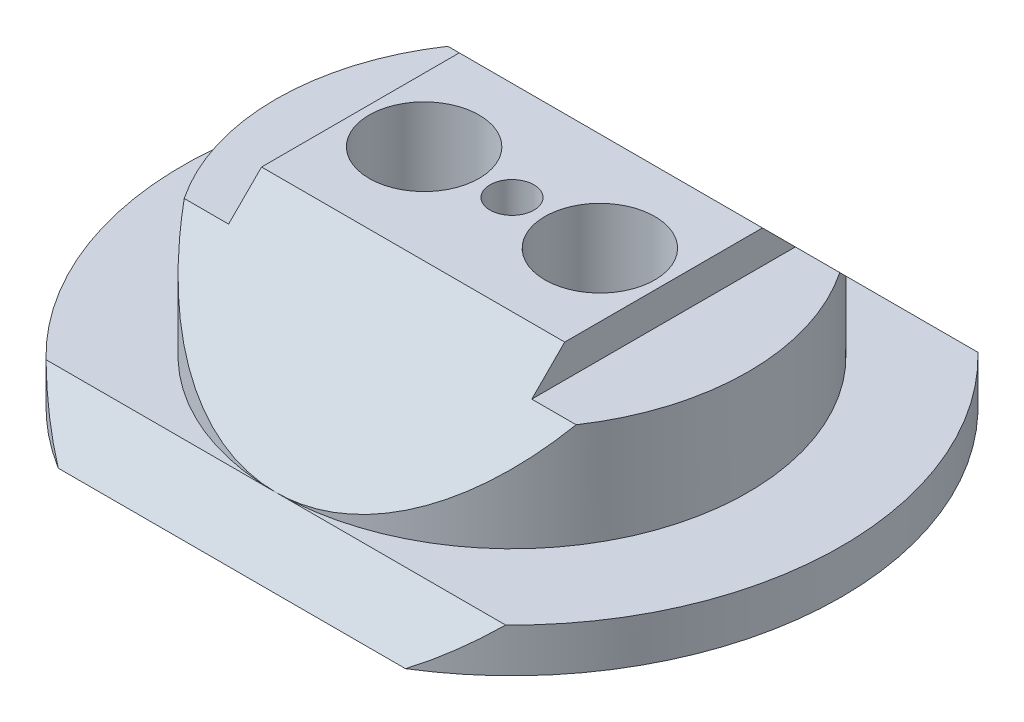
from build123d import *
from build123d.topology import SkipClean

# Parameters (mm, degrees)
SKETCH1_R                            = 30
BOSS_EXTRUDE1_DEPTH                  = 4
BOSS_EXTRUDE2_REACH                  = 44.615
BOSS_EXTRUDE2_END_RADIUS             = 30
BOSS_EXTRUDE2_DIRECTION_2_REACH      = 44.615
BOSS_EXTRUDE2_DIRECTION_2_END_RADIUS = 30
SKETCH3_OUTSIDE_W                    = 78.092
SKETCH3_OUTSIDE_H                    = 69.092
SKETCH3_OUTSIDE_R                    = 21.5
CUT_EXTRUDE2_DEPTH                   = 12.5
BOSS_EXTRUDE3_DEPTH                  = 18
BOSS_EXTRUDE4_DEPTH                  = 15
BOSS_EXTRUDE5_DEPTH                  = 15
CUT_EXTRUDE3_DEPTH                   = 44.292609069
CUT_EXTRUDE3_DEPTH_BACK              = 44.292609069
SKETCH8_R                            = 2
CUT_EXTRUDE8_DEPTH                   = 48.077064479
CUT_EXTRUDE8_DEPTH_BACK              = 48.077064479
CUT_EXTRUDE9_DEPTH                   = 59.659818207
CUT_EXTRUDE11_DEPTH                  = 20
CUT_EXTRUDE12_DEPTH                  = 20
CUT_EXTRUDE13_DEPTH                  = 20
CUT_EXTRUDE14_DEPTH                  = 44.292609069
CUT_EXTRUDE14_DEPTH_BACK             = 44.292609069
SKETCH25_W                           = 66.075437062
SKETCH25_H                           = 20.142243048
SKETCH26_R                           = 5.005
CUT_EXTRUDE15_DEPTH                  = 24
CUT_EXTRUDE17_DEPTH                  = 47.524187258
CUT_EXTRUDE17_DEPTH_BACK             = 47.524187258
SKETCH29_W                           = 7.7
SKETCH29_H                           = 3
CUT_EXTRUDE18_DEPTH                  = 47.524187258
CUT_EXTRUDE18_DEPTH_BACK             = 47.524187258
SKETCH31_W                           = 7.7
SKETCH31_H                           = 3
SKETCH34_R                           = 1.5
CUT_EXTRUDE21_DEPTH                  = 20
SKETCH35_R                           = 2
CUT_EXTRUDE22_DEPTH                  = 3
SKETCH37_R                           = 5
CUT_EXTRUDE23_DEPTH                  = 3


with BuildPart() as part:
    # Sketch1 → Boss-Extrude1 (new body)
    with BuildSketch(Plane(origin=(0, 0, 0), x_dir=(1, 0, 0), z_dir=(0, 1, 0))):
        with Locations(Location((0, 0, 0), (0, 0, 270))):
            Circle(SKETCH1_R)
    extrude(amount=BOSS_EXTRUDE1_DEPTH)

    # Boss-Extrude2: up to this cylinder (the profile starts inside it)
    with SkipClean():  # the faces are left unmerged after this step: merging them gives an invalid solid
        boss_extrude2_end = Plane(origin=(0, 9.396175, 0), z_dir=(0, -1, 0)) * Cylinder(BOSS_EXTRUDE2_END_RADIUS, 150.23, mode=Mode.PRIVATE)
        # Sketch2 → Boss-Extrude2 (add, up to the surface)
        with BuildSketch(Plane(origin=(0, 0, 0), x_dir=(0, 0, -1), z_dir=(1, 0, 0)), mode=Mode.PRIVATE) as boss_extrude2_sk1:
            Polygon((0, 4), (21.5, 4), (9, 16.5), (-9, 16.5), (-21.5, 4), align=None)
        boss_extrude2_tool1 = extrude(boss_extrude2_sk1.sketch, amount=BOSS_EXTRUDE2_REACH, mode=Mode.PRIVATE) & boss_extrude2_end
        add(boss_extrude2_tool1.solids().sort_by_distance((0, 9.396175, 0))[0])

    # Boss-Extrude2 direction 2: up to this cylinder (the profile starts inside it)
    with SkipClean():  # the faces are left unmerged after this step: merging them gives an invalid solid
        boss_extrude2_direction_2_end = Plane(origin=(0, 9.396175, 0), z_dir=(0, -1, 0)) * Cylinder(BOSS_EXTRUDE2_DIRECTION_2_END_RADIUS, 150.23, mode=Mode.PRIVATE)
        # Sketch2 → Boss-Extrude2 direction 2 (add, up to the surface)
        with BuildSketch(Plane(origin=(0, 0, 0), x_dir=(0, 0, -1), z_dir=(1, 0, 0)), mode=Mode.PRIVATE) as boss_extrude2_direction_2_sk1:
            Polygon((0, 4), (21.5, 4), (9, 16.5), (-9, 16.5), (-21.5, 4), align=None)
        boss_extrude2_direction_2_tool1 = extrude(boss_extrude2_direction_2_sk1.sketch, amount=-BOSS_EXTRUDE2_DIRECTION_2_REACH, mode=Mode.PRIVATE) & boss_extrude2_direction_2_end
        add(boss_extrude2_direction_2_tool1.solids().sort_by_distance((0, 9.396175, 0))[0])

    # SurfaceCut1
    split(bisect_by=Plane(origin=(0, 12.75, -12.75), x_dir=(1, 0, 0), z_dir=(0, 0.7071067811865558, -0.7071067811865392)), keep=Keep.BOTTOM)

    # SurfaceCut2
    split(bisect_by=Plane(origin=(0, 12.75, 12.75), x_dir=(1, 0, 0), z_dir=(0, 0.7071067811865509, 0.7071067811865442)), keep=Keep.BOTTOM)

    # Sketch3 outside → Cut-Extrude2 (cut)
    with BuildSketch(Plane(origin=(0, 4, 0), x_dir=(1, 0, 0), z_dir=(0, 1, 0))):
        Rectangle(SKETCH3_OUTSIDE_W, SKETCH3_OUTSIDE_H)
        Circle(SKETCH3_OUTSIDE_R, mode=Mode.SUBTRACT)
    extrude(amount=CUT_EXTRUDE2_DEPTH, mode=Mode.SUBTRACT)

    # Sketch5 → Boss-Extrude3 (add)
    with BuildSketch(Plane(origin=(0, 0, 0), x_dir=(-1, 0, 0), z_dir=(0, -1, 0))):
        Polygon((0, -6), (-17.5, -6), (-17.5, 6), (17.5, 6), (17.5, -6), align=None)
    extrude(amount=BOSS_EXTRUDE3_DEPTH)

    # Sketch6 → Boss-Extrude4 (add)
    with BuildSketch(Plane.XZ):
        Polygon((0, 15), (7, 15), (7, 6), (-7, 6), (-7, 15), align=None)
    extrude(amount=BOSS_EXTRUDE4_DEPTH)

    # Sketch7 → Boss-Extrude5 (add)
    with BuildSketch(Plane.XZ):
        Polygon((0, -15), (7, -15), (7, -6), (-7, -6), (-7, -15), align=None)
    extrude(amount=BOSS_EXTRUDE5_DEPTH)

    # Sketch8 → Cut-Extrude3 (cut, two sides: drawn at the far end of the back side and taken through both)
    with BuildSketch(Plane.XY.offset(-CUT_EXTRUDE3_DEPTH_BACK)):
        with Locations((-12.5, -12.5)):
            Circle(SKETCH8_R)
        with Locations((12.5, -12.5)):
            Circle(SKETCH8_R)
    extrude(amount=CUT_EXTRUDE3_DEPTH + CUT_EXTRUDE3_DEPTH_BACK, mode=Mode.SUBTRACT)

    # Sketch16 → Cut-Extrude8 (cut, two sides: drawn at the far end of the back side and taken through both)
    with BuildSketch(Plane.XY.offset(6).offset(-CUT_EXTRUDE8_DEPTH_BACK)):
        Polygon((17.5, -18), (17.5, -14.5), (14, -18), align=None)
        Polygon((-17.5, -18), (-14, -18), (-17.5, -14.5), align=None)
    extrude(amount=CUT_EXTRUDE8_DEPTH + CUT_EXTRUDE8_DEPTH_BACK, mode=Mode.SUBTRACT)

    # Sketch17 → Cut-Extrude9 (cut, through all)
    with BuildSketch(Plane(origin=(10.365975269, -9.674910251, -8.062425209), x_dir=(-0.3613483622370374, 0.337258471421235, -0.8693009171531012), z_dir=(0.6355070151731325, -0.5931398808282571, -0.49428323402354774))):
        Polygon((-2.372510104, -6.189601271), (7.980636686, -0.706686759), (7.980636686, -10.965829024), align=None)
    extrude(amount=CUT_EXTRUDE9_DEPTH, mode=Mode.SUBTRACT)

    # Sketch19 → Cut-Extrude11 (cut)
    with BuildSketch(Plane(origin=(-10.365975269, -9.674910251, -8.062425209), x_dir=(0.3613483622370374, 0.33725847142123494, -0.8693009171531012), z_dir=(0.6355070151731324, 0.5931398808282571, 0.4942832340235476))):
        Polygon((-2.372510104, -6.189601271), (7.980636686, -10.965829024), (7.980636686, -0.706686759), align=None)
    extrude(amount=-CUT_EXTRUDE11_DEPTH, mode=Mode.SUBTRACT)

    # Sketch20 → Cut-Extrude12 (cut)
    with BuildSketch(Plane(origin=(-10.365975269, -9.674910251, 8.062425209), x_dir=(-0.3613483622370374, -0.3372584714212349, -0.8693009171531013), z_dir=(0.6355070151731326, 0.593139880828257, -0.49428323402354757))):
        Polygon((2.372510104, -6.189601271), (-7.980636686, -0.706686759), (-7.980636686, -10.965829024), align=None)
    extrude(amount=-CUT_EXTRUDE12_DEPTH, mode=Mode.SUBTRACT)

    # Sketch21 → Cut-Extrude13 (cut)
    with BuildSketch(Plane(origin=(10.365975269, -9.674910251, 8.062425209), x_dir=(-0.3613483622370374, 0.3372584714212349, 0.8693009171531013), z_dir=(-0.6355070151731326, 0.593139880828257, -0.49428323402354757))):
        Polygon((-2.372510104, -6.189601271), (7.980636686, -0.706686759), (7.980636686, -10.965829024), align=None)
    extrude(amount=-CUT_EXTRUDE13_DEPTH, mode=Mode.SUBTRACT)

    # Sketch25 → Cut-Extrude14 (cut, two sides: drawn at the far end of the back side and taken through both)
    with BuildSketch(Plane.XY.offset(-CUT_EXTRUDE14_DEPTH_BACK)):
        with Locations((0, -10.071121524)):
            Rectangle(SKETCH25_W, SKETCH25_H)
    extrude(amount=CUT_EXTRUDE14_DEPTH + CUT_EXTRUDE14_DEPTH_BACK, mode=Mode.SUBTRACT)

    # Sketch26 → Cut-Extrude15 (cut)
    with BuildSketch(Plane(origin=(0, 16.5, 0), x_dir=(1, 0, 0), z_dir=(0, 1, 0))):
        with Locations(Location((-8, 0, 0), (0, 0, 270))):
            Circle(SKETCH26_R)
        with Locations(Location((8, 0, 0), (0, 0, 270))):
            Circle(SKETCH26_R)
    extrude(amount=-CUT_EXTRUDE15_DEPTH, mode=Mode.SUBTRACT)

    # Sketch29 → Cut-Extrude17 (cut, two sides: drawn at the far end of the back side and taken through both)
    with BuildSketch(Plane.XY.offset(6).offset(-CUT_EXTRUDE17_DEPTH_BACK)):
        with Locations((17.65, 15)):
            Rectangle(SKETCH29_W, SKETCH29_H)
    extrude(amount=CUT_EXTRUDE17_DEPTH + CUT_EXTRUDE17_DEPTH_BACK, mode=Mode.SUBTRACT)

    # Sketch31 → Cut-Extrude18 (cut, two sides: drawn at the far end of the back side and taken through both)
    with BuildSketch(Plane.XY.offset(6).offset(-CUT_EXTRUDE18_DEPTH_BACK)):
        with Locations((-17.65, 15)):
            Rectangle(SKETCH31_W, SKETCH31_H)
    extrude(amount=CUT_EXTRUDE18_DEPTH + CUT_EXTRUDE18_DEPTH_BACK, mode=Mode.SUBTRACT)

    # Sketch34 → Cut-Extrude21 (cut)
    with BuildSketch(Plane.XZ):
        with Locations(Location((0, 0, 0), (0, 0, 270))):
            Circle(SKETCH34_R)
    extrude(amount=-CUT_EXTRUDE21_DEPTH, mode=Mode.SUBTRACT)

    # Sketch35 → Cut-Extrude22 (cut)
    with BuildSketch(Plane(origin=(0, 16.5, 0), x_dir=(1, 0, 0), z_dir=(0, 1, 0))):
        with Locations(Location((0, 0, 0), (0, 0, 270))):
            Circle(SKETCH35_R)
    extrude(amount=-CUT_EXTRUDE22_DEPTH, mode=Mode.SUBTRACT)

    # Sketch37 → Cut-Extrude23 (cut)
    with BuildSketch(Plane.XZ):
        with Locations(Location((0, -15, 0), (0, 0, 270))):
            Circle(SKETCH37_R)
        with Locations(Location((0, 15, 0), (0, 0, 270))):
            Circle(SKETCH37_R)
        with Locations(Location((-22, 0, 0), (0, 0, 270))):
            Circle(SKETCH37_R)
        with Locations(Location((22, 0, 0), (0, 0, 270))):
            Circle(SKETCH37_R)
        with Locations(Location((-14, 12, 0), (0, 0, 270))):
            Circle(SKETCH37_R)
        with Locations(Location((14, 12, 0), (0, 0, 270))):
            Circle(SKETCH37_R)
        with Locations(Location((-14, -12, 0), (0, 0, 270))):
            Circle(SKETCH37_R)
        with Locations(Location((14, -12, 0), (0, 0, 270))):
            Circle(SKETCH37_R)
    extrude(amount=-CUT_EXTRUDE23_DEPTH, mode=Mode.SUBTRACT)


solid = part.part
